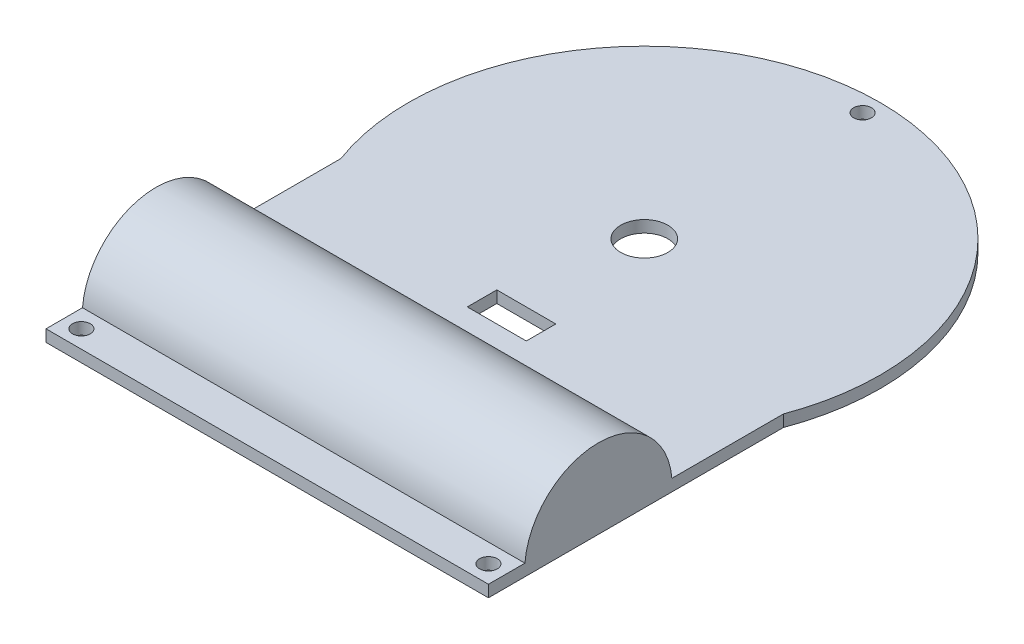
from build123d import *
from build123d.topology import SkipClean

# Parameters (mm, degrees)
BOSS_EXTRUDE1_DEPTH = 2
SKETCH2_R           = 4
CUT_EXTRUDE1_DEPTH  = 2
SKETCH3_W           = 10
SKETCH3_H           = 5
CUT_EXTRUDE2_DEPTH  = 10
SKETCH7_R           = 1.5
CUT_EXTRUDE3_DEPTH  = 10
SKETCH8_R           = 10.5
CUT_EXTRUDE4_DEPTH  = 101.478560353
BOSS_EXTRUDE2_DEPTH = 75
BOSS_EXTRUDE3_DEPTH = 2
BOSS_EXTRUDE4_DEPTH = 2


with BuildPart() as part:
    # Sketch1 → Boss-Extrude1 (new body)
    with BuildSketch(Plane(origin=(0, 0, 0), x_dir=(1, 0, 0), z_dir=(0, 1, 0))):
        with BuildLine():
            Line((-37.5, -63.919410907), (37.5, -63.919410907))
            Line((37.5, -63.919410907), (37.5, -13.919410907))
            ThreePointArc((37.5, -13.919410907), (0, 40), (-37.5, -13.919410907))
            Line((-37.5, -13.919410907), (-37.5, -63.919410907))
        make_face()
    extrude(amount=BOSS_EXTRUDE1_DEPTH)

    # Sketch2 → Cut-Extrude1 (cut)
    with BuildSketch(Plane(origin=(0, 2, 0), x_dir=(1, 0, 0), z_dir=(0, 1, 0))):
        with Locations(Location((0, 0, 0), (0, 0, 270))):
            Circle(SKETCH2_R)
    extrude(amount=-CUT_EXTRUDE1_DEPTH, mode=Mode.SUBTRACT)

    # Sketch3 → Cut-Extrude2 (cut)
    with BuildSketch(Plane(origin=(0, 2, 0), x_dir=(1, 0, 0), z_dir=(0, 1, 0))):
        with Locations((0, -22.5)):
            Rectangle(SKETCH3_W, SKETCH3_H)
    extrude(amount=-CUT_EXTRUDE2_DEPTH, mode=Mode.SUBTRACT)

    # Sketch7 → Cut-Extrude3 (cut)
    with BuildSketch(Plane(origin=(0, 2, 0), x_dir=(1, 0, 0), z_dir=(0, 1, 0))):
        with Locations(Location((0, 37, 0), (0, 0, 270))):
            Circle(SKETCH7_R)
        with Locations(Location((-34.5, -60.919410907, 0), (0, 0, 270))):
            Circle(SKETCH7_R)
        with Locations(Location((34.5, -60.919410907, 0), (0, 0, 270))):
            Circle(SKETCH7_R)
    extrude(amount=-CUT_EXTRUDE3_DEPTH, mode=Mode.SUBTRACT)

    # Sketch8 → Cut-Extrude4 (cut, through all)
    with BuildSketch(Plane.ZY.offset(37.5)):
        with Locations((45.278815685, 0.949918898)):
            Circle(SKETCH8_R)
    extrude(amount=-CUT_EXTRUDE4_DEPTH, mode=Mode.SUBTRACT)


with BuildPart() as cut_extrude4_piece_1:
    # of the separate pieces the step leaves, piece 1, a body of its own (cut_extrude4_pieces)
    add(part.part.solids().sort_by_distance((-37.5, 0, 13.919410907))[0])



with BuildPart() as cut_extrude4_piece_2:
    # of the separate pieces the step leaves, piece 2, a body of its own (cut_extrude4_pieces)
    add(part.part.solids().sort_by_distance((-37.5, 0, 55.73575855))[0])


with BuildPart() as cut_extrude4_piece_1_1:
    with SkipClean():  # the faces are left unmerged after this step: merging them gives an invalid solid
        add(cut_extrude4_piece_1.part)

        add(cut_extrude4_piece_2.part)  # Boss-Extrude2 merges Cut-Extrude4 piece 2
        # Sketch9 → Boss-Extrude2 (add)
        with BuildSketch(Plane.ZY.offset(37.5)):
            with BuildLine():
                Line((32.814961783, 0), (34.821872819, 0))
                ThreePointArc((34.821872819, 0), (45.278815685, 11.449918898), (55.73575855, 0))
                Line((55.73575855, 0), (57.742669586, 0))
                ThreePointArc((57.742669586, 0), (45.278815685, 13.449918898), (32.814961783, 0))
            make_face()
        extrude(amount=-BOSS_EXTRUDE2_DEPTH)

    # Sketch10 → Boss-Extrude3 (add)
    with BuildSketch(Plane.ZY.offset(37.5)):
        with BuildLine():
            Line((32.814961783, 0), (57.742669586, 0))
            ThreePointArc((57.742669586, 0), (45.278815685, 13.449918898), (32.814961783, 0))
        make_face()
    extrude(amount=-BOSS_EXTRUDE3_DEPTH)

    # Sketch11 → Boss-Extrude4 (add)
    with SkipClean():  # the faces are left unmerged after this step: merging them gives an invalid solid
        with BuildSketch(Plane(origin=(37.5, 0, 0), x_dir=(0, 0, -1), z_dir=(1, 0, 0))):
            with BuildLine():
                Line((-57.742669586, 0), (-32.814961783, 0))
                ThreePointArc((-32.814961783, 0), (-45.278815685, 13.449918898), (-57.742669586, 0))
            make_face()
        extrude(amount=-BOSS_EXTRUDE4_DEPTH)


solid = cut_extrude4_piece_1_1.part
